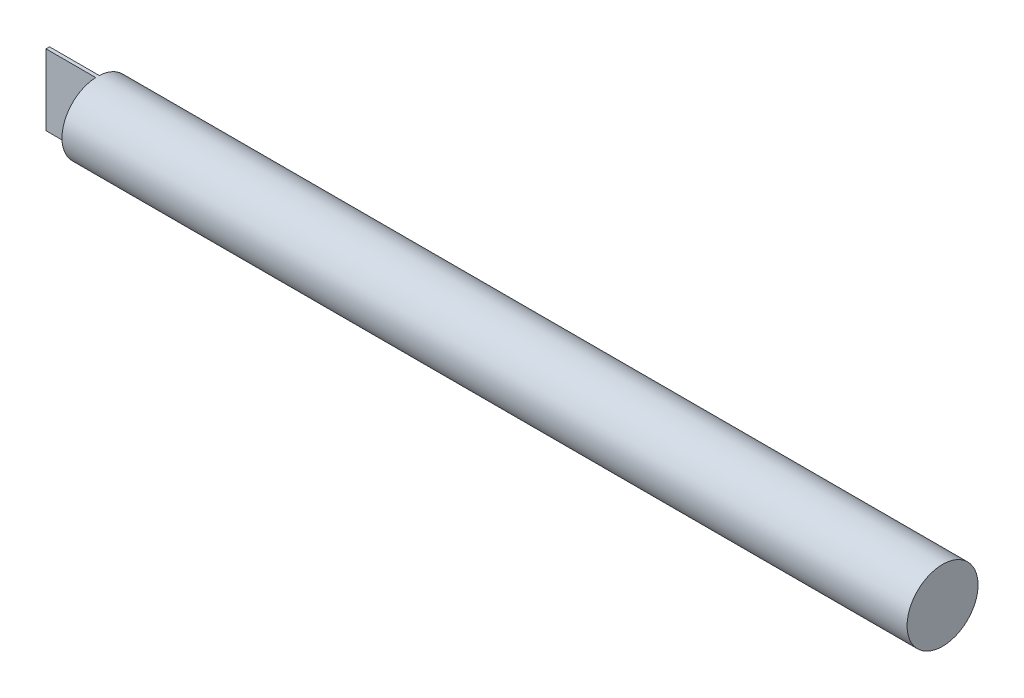
from build123d import *

# Parameters (mm, degrees)
SKETCH1_W                   = 126
SKETCH1_H                   = 5
ENCAIXE_START               = -7
ENCAIXE_POTENCI_METRO_DEPTH = 7


with BuildPart() as part:
    # Sketch1 → Blank (revolve)
    with BuildSketch(Plane.XY, mode=Mode.PRIVATE) as blank_sk:
        with Locations((0, 2.5)):
            Rectangle(SKETCH1_W, SKETCH1_H)
    revolve(blank_sk.sketch.rotate(Axis((-63, 0, 0), (1, 0, 0)), 90), axis=Axis((-63, 0, 0), (1, 0, 0)))

    # Sketch2 → Encaixe - Potenciômetro (cut)
    with BuildSketch(Plane.ZY.offset(63).offset(ENCAIXE_START)):
        with BuildLine():
            Line((0.25, 4.993746089), (0.25, -4.993746089))
            ThreePointArc((0.25, -4.993746089), (3.622844187, -3.446012188), (5, 0))
            ThreePointArc((5, 0), (3.622844187, 3.446012188), (0.25, 4.993746089))
        make_face()
        with BuildLine():
            ThreePointArc((-0.25, 4.993746089), (-5, 0), (-0.25, -4.993746089))
            Line((-0.25, -4.993746089), (-0.25, 4.993746089))
        make_face()
    extrude(amount=ENCAIXE_POTENCI_METRO_DEPTH, mode=Mode.SUBTRACT)


solid = part.part
